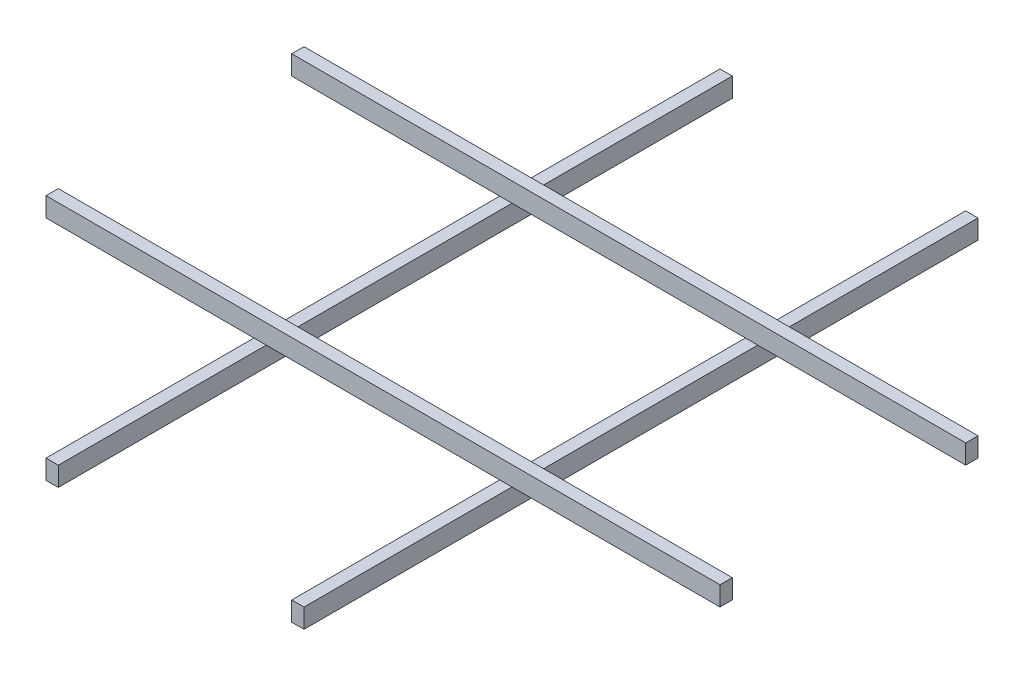
from build123d import *

# Parameters (mm, degrees)
SKETCH1_W              = 88.9
SKETCH1_H              = 139.7
PROFILES_4X6_1_DEPTH   = 4876.8
SKETCH1_ON_SEGMENT_2_W = 88.9
SKETCH1_ON_SEGMENT_2_H = 139.7
PROFILES_4X6_1_2_DEPTH = 4876.8
SKETCH1_ON_SEGMENT_3_W = 88.9
SKETCH1_ON_SEGMENT_3_H = 139.7
PROFILES_4X6_1_3_DEPTH = 4876.8
SKETCH1_ON_SEGMENT_4_W = 88.9
SKETCH1_ON_SEGMENT_4_H = 139.7
PROFILES_4X6_1_4_DEPTH = 4876.8


with BuildPart() as part:
    # Sketch1 → Profiles 4X6(1) (new body)
    with BuildSketch(Plane(origin=(1244.6, 0, 0), x_dir=(-1, 0, 0), z_dir=(0, 0, -1))):
        Rectangle(SKETCH1_W, SKETCH1_H)
    extrude(amount=PROFILES_4X6_1_DEPTH)


with BuildPart() as body_2:
    # Sketch1 on segment 2 (carried to segment 2) → Profiles 4X6_1 2 (new body)
    with BuildSketch(Plane(origin=(3022.6, 0, 0), x_dir=(-1, 0, 0), z_dir=(0, 0, -1))):
        Rectangle(SKETCH1_ON_SEGMENT_2_W, SKETCH1_ON_SEGMENT_2_H)
    extrude(amount=PROFILES_4X6_1_2_DEPTH)


with BuildPart() as body_3:
    # Sketch1 on segment 3 (carried to segment 3) → Profiles 4X6_1 3 (new body)
    with BuildSketch(Plane(origin=(-304.8, 139.7, -3327.4), x_dir=(0, 0, -1), z_dir=(1, 0, 0))):
        Rectangle(SKETCH1_ON_SEGMENT_3_W, SKETCH1_ON_SEGMENT_3_H)
    extrude(amount=PROFILES_4X6_1_3_DEPTH)


with BuildPart() as body_4:
    # Sketch1 on segment 4 (carried to segment 4) → Profiles 4X6_1 4 (new body)
    with BuildSketch(Plane(origin=(4572, 139.7, -1549.4), x_dir=(0, 0, 1), z_dir=(-1, 0, 0))):
        Rectangle(SKETCH1_ON_SEGMENT_4_W, SKETCH1_ON_SEGMENT_4_H)
    extrude(amount=PROFILES_4X6_1_4_DEPTH)


solid = Compound([part.part, body_2.part, body_3.part, body_4.part])
